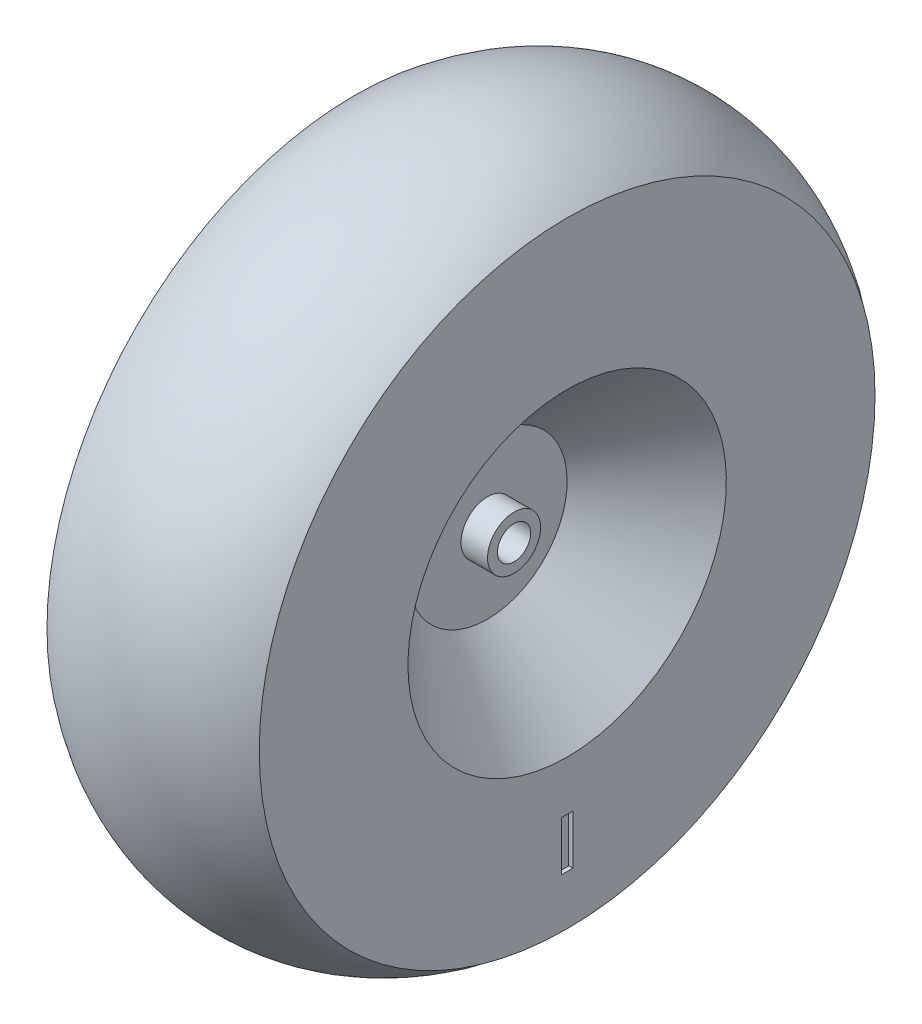
from build123d import *

# Parameters (mm, degrees)
SKETCH8_W          = 5.505636966
SKETCH8_H          = 23.71955036
CUT_EXTRUDE1_DEPTH = 2


with BuildPart() as part:
    # Sketch7 → Revolve6 (revolve)
    with BuildSketch(Plane.XY, mode=Mode.PRIVATE) as revolve6_sk:
        with BuildLine():
            Line((50.8, 76.2), (50.8, 147.35865108))
            add(Edge.make_bspline(
                [(50.8, 147.35865108), (0, 187.484544424), (-50.8, 147.35865108)],
                knots=[2.485810722, 2.485810722, 2.485810722, 3.797374586, 3.797374586, 3.797374586], degree=2, weights=[1, 0.792571365, 1]))
            Line((-50.8, 147.35865108), (-50.8, 76.2))
            Line((-50.8, 76.2), (-12.7, 38.1))
            Line((-12.7, 38.1), (-12.7, 12.7))
            Line((-12.7, 12.7), (-25.4, 12.7))
            Line((-25.4, 12.7), (-25.4, 7.9375))
            Line((-25.4, 7.9375), (25.4, 7.9375))
            Line((25.4, 7.9375), (25.4, 12.7))
            Line((25.4, 12.7), (12.7, 12.7))
            Line((12.7, 12.7), (12.7, 38.1))
            Line((12.7, 38.1), (50.8, 76.2))
        make_face()
    revolve(revolve6_sk.sketch.rotate(Axis((-25.4, 0, 0), (1, 0, 0)), 180), axis=Axis((-25.4, 0, 0), (1, 0, 0)))

    # Sketch8 → Cut-Extrude1 (cut)
    with BuildSketch(Plane(origin=(50.8, 0, 0), x_dir=(0, 0, -1), z_dir=(1, 0, 0))):
        with Locations((0, -111.77932554)):
            Rectangle(SKETCH8_W, SKETCH8_H)
    extrude(amount=-CUT_EXTRUDE1_DEPTH, mode=Mode.SUBTRACT)


solid = part.part
